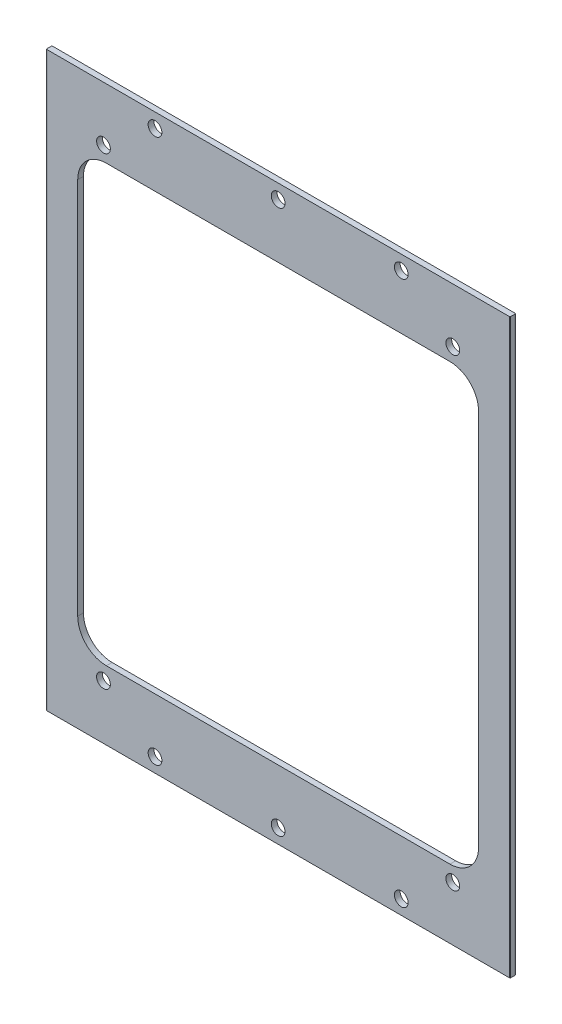
from build123d import *

# Parameters (mm, degrees)
SKETCH1_W           = 81
SKETCH1_H           = 100
BOSS_EXTRUDE1_DEPTH = 0.5
CUT_EXTRUDE1_DEPTH  = 65.352544627
M2_HOLE1_AD_D       = 2.4
M2_HOLE1_AD_DEPTH   = 100
M2_HOLE1_AD_TIP     = 0.721032743
M2_HOLE2_AD_D       = 2.4
M2_HOLE2_AD_DEPTH   = 100
M2_HOLE2_AD_TIP     = 0.721032743
M2_HOLE3_AE_D       = 2.4
M2_HOLE3_AE_DEPTH   = 200
M2_HOLE3_AE_TIP     = 0.721032743
FILLET1_R           = 0.1


with BuildPart() as part:
    # Sketch1 → Boss-Extrude1 (new, symmetric)
    with BuildSketch(Plane.XY):
        Rectangle(SKETCH1_W, SKETCH1_H)
    extrude(amount=BOSS_EXTRUDE1_DEPTH, both=True)

    # Sketch2 → Cut-Extrude1 (cut, through all)
    with BuildSketch(Plane.XY.offset(0.5)):
        with BuildLine():
            Line((-30, -38), (30, -38))
            ThreePointArc((30, -38), (33.535533906, -36.535533906), (35, -33))
            Line((35, -33), (35, 33))
            ThreePointArc((35, 33), (33.535533906, 36.535533906), (30, 38))
            Line((30, 38), (-30, 38))
            ThreePointArc((-30, 38), (-33.535533906, 36.535533906), (-35, 33))
            Line((-35, 33), (-35, -33))
            ThreePointArc((-35, -33), (-33.535533906, -36.535533906), (-30, -38))
        make_face()
    extrude(amount=-CUT_EXTRUDE1_DEPTH, mode=Mode.SUBTRACT)

    # M2 Hole1 - AD
    with Locations(Plane.XY.offset(0.5)):
        with Locations((-30.5, 40.5), (30.5, 40.5), (-30.5, -40.5), (30.5, -40.5)):
            Hole(M2_HOLE1_AD_D / 2, depth=M2_HOLE1_AD_DEPTH)
            with Locations((0, 0, -(M2_HOLE1_AD_DEPTH + M2_HOLE1_AD_TIP / 2))):  # 118° drill point
                Cone(0, M2_HOLE1_AD_D / 2, M2_HOLE1_AD_TIP, mode=Mode.SUBTRACT)

    # M2 Hole2 - AD
    with Locations(Plane.XY.offset(0.5)):
        with Locations((-21.5, 47.5), (21.5, 47.5), (-21.5, -47.5), (21.5, -47.5)):
            Hole(M2_HOLE2_AD_D / 2, depth=M2_HOLE2_AD_DEPTH)
            with Locations((0, 0, -(M2_HOLE2_AD_DEPTH + M2_HOLE2_AD_TIP / 2))):  # 118° drill point
                Cone(0, M2_HOLE2_AD_D / 2, M2_HOLE2_AD_TIP, mode=Mode.SUBTRACT)

    # M2 Hole3 - AE
    with Locations(Plane.XY.offset(0.5)):
        with Locations((0, 47.5), (0, -47.5)):
            Hole(M2_HOLE3_AE_D / 2, depth=M2_HOLE3_AE_DEPTH)
            with Locations((0, 0, -(M2_HOLE3_AE_DEPTH + M2_HOLE3_AE_TIP / 2))):  # 118° drill point
                Cone(0, M2_HOLE3_AE_D / 2, M2_HOLE3_AE_TIP, mode=Mode.SUBTRACT)

    # Fillet1
    fillet1_edges = [part.edges().sort_by_distance(p)[0] for p in [
        (-40.5, 0, 0.5),
        (40.5, 0, 0.5),
        (-40.5, 0, -0.5),
        (40.5, 0, -0.5),
    ]]
    fillet(fillet1_edges, radius=FILLET1_R)


solid = part.part
